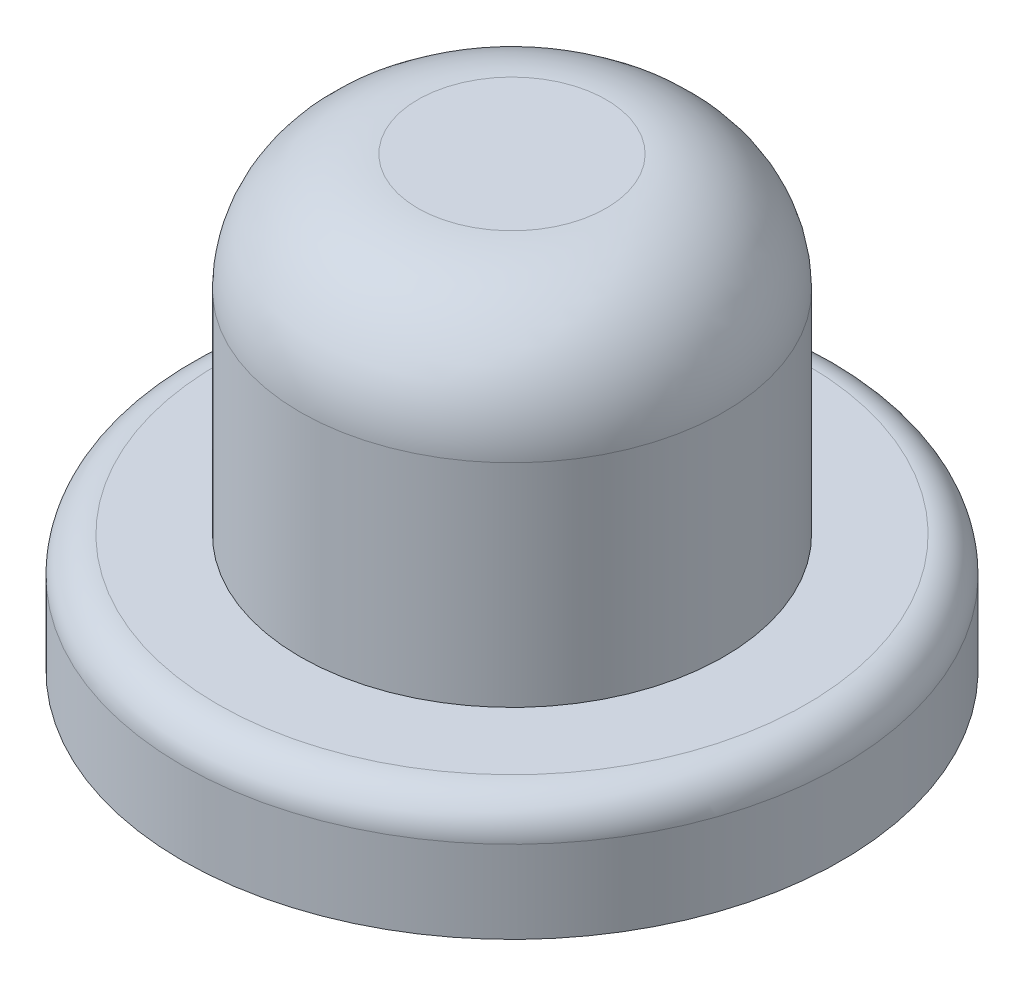
from build123d import *

# Parameters (mm, degrees)
SKETCH_1_R      = 2.8
EXTRUDE_2_DEPTH = 1
SKETCH_2_R      = 1.8
EXTRUDE_3_DEPTH = 2.8
FILLET_1_R      = 1
FILLET_2_R      = 0.3


with BuildPart() as part:
    # 草图1 → 凸台-拉伸2 (new body)
    with BuildSketch(Plane(origin=(0, 0, 0), x_dir=(1, 0, 0), z_dir=(0, 1, 0))):
        with Locations(Location((0, 0, 0), (0, 0, 270))):
            Circle(SKETCH_1_R)
    extrude(amount=EXTRUDE_2_DEPTH)

    # 草图2 → 凸台-拉伸3 (add)
    with BuildSketch(Plane(origin=(0, 1, 0), x_dir=(1, 0, 0), z_dir=(0, 1, 0))):
        with Locations(Location((0, 0, 0), (0, 0, 270))):
            Circle(SKETCH_2_R)
    extrude(amount=EXTRUDE_3_DEPTH)

    # 圆角1
    fillet_1_edges = [part.edges().sort_by_distance(p)[0] for p in [
        (0, 3.8, -1.8),
    ]]
    fillet(fillet_1_edges, radius=FILLET_1_R)

    # 圆角2
    fillet_2_edges = [part.edges().sort_by_distance(p)[0] for p in [
        (0, 1, -2.8),
    ]]
    fillet(fillet_2_edges, radius=FILLET_2_R)


solid = part.part
